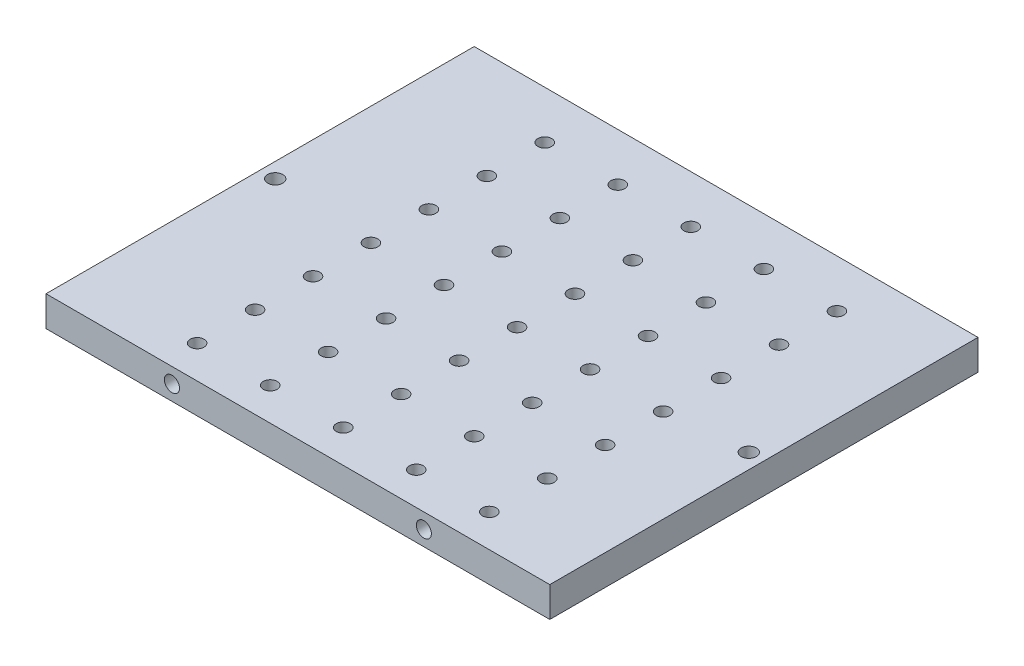
from build123d import *

# Parameters (mm, degrees)
ESQUISSE1_W                     = 100
ESQUISSE1_H                     = 85
BOSS_EXTRU_1_DEPTH              = 6
ESQUISSE2_R                     = 1.5
ENL_V_MAT_EXTRU_1_DEPTH         = 85
ENL_V_MAT_EXTRU_2_REACH         = 67.896
ESQUISSE3_R                     = 1.375
R_P_TITION_LIN_AIRE1_COUNT      = 7
R_P_TITION_LIN_AIRE1_PITCH      = 11.5
R_P_TITION_LIN_AIRE1_COUNT_DIR2 = 5
R_P_TITION_LIN_AIRE1_PITCH_DIR2 = 14.5
ESQUISSE4_R                     = 1.5
ENL_V_MAT_EXTRU_3_DEPTH         = 6


with BuildPart() as part:
    # Esquisse1 → Boss.-Extru.1 (new body)
    with BuildSketch(Plane(origin=(0, 0, 0), x_dir=(1, 0, 0), z_dir=(0, 1, 0))):
        Rectangle(ESQUISSE1_W, ESQUISSE1_H)
    extrude(amount=BOSS_EXTRU_1_DEPTH)

    # Esquisse2 → Enlèv. mat.-Extru.1 (cut)
    with BuildSketch(Plane.XY.offset(42.5)):
        with Locations((-25, 3)):
            Circle(ESQUISSE2_R)
        with Locations((25, 3)):
            Circle(ESQUISSE2_R)
    extrude(amount=-ENL_V_MAT_EXTRU_1_DEPTH, mode=Mode.SUBTRACT)

    # Enlèv. mat.-Extru.2: up to this face of the body (flat: up to its plane)
    enl_v_mat_extru_2_end = Plane(part.part.faces().sort_by_distance((0, 6, 0))[0])
    # Esquisse3 → Enlèv. mat.-Extru.2 (cut, up to the picked face)
    with BuildSketch(Plane(origin=(0, 0, 0), x_dir=(1, 0, 0), z_dir=(0, 1, 0)), mode=Mode.PRIVATE) as enl_v_mat_extru_2_sk1:
        with Locations(Location((-26.5, 33, 0), (0, 0, 90))):
            Circle(ESQUISSE3_R)
    enl_v_mat_extru_2_tool1 = split(extrude(enl_v_mat_extru_2_sk1.sketch, amount=ENL_V_MAT_EXTRU_2_REACH, mode=Mode.PRIVATE), bisect_by=enl_v_mat_extru_2_end, keep=Keep.BOTH, mode=Mode.PRIVATE)
    enl_v_mat_extru_2 = enl_v_mat_extru_2_tool1.solids().sort_by(Axis((-26.5, 0, -33), (0, 1, 0)))[0]
    add(enl_v_mat_extru_2, mode=Mode.SUBTRACT)

    # Répétition linéaire1: Enl_v. mat.-Extru.2 7 × 5
    with Locations(*[(j * R_P_TITION_LIN_AIRE1_PITCH_DIR2, 0, i * R_P_TITION_LIN_AIRE1_PITCH) for i in range(R_P_TITION_LIN_AIRE1_COUNT) for j in range(R_P_TITION_LIN_AIRE1_COUNT_DIR2) if (i, j) != (0, 0)]):
        add(enl_v_mat_extru_2, mode=Mode.SUBTRACT)

    # Esquisse4 → Enlèv. mat.-Extru.3 (cut)
    with BuildSketch(Plane(origin=(0, 0, 0), x_dir=(1, 0, 0), z_dir=(0, 1, 0))):
        with Locations(Location((-47, 0, 0), (0, 0, 90))):
            Circle(ESQUISSE4_R)
        with Locations(Location((47, 0, 0), (0, 0, 90))):
            Circle(ESQUISSE4_R)
    extrude(amount=ENL_V_MAT_EXTRU_3_DEPTH, mode=Mode.SUBTRACT)


solid = part.part
